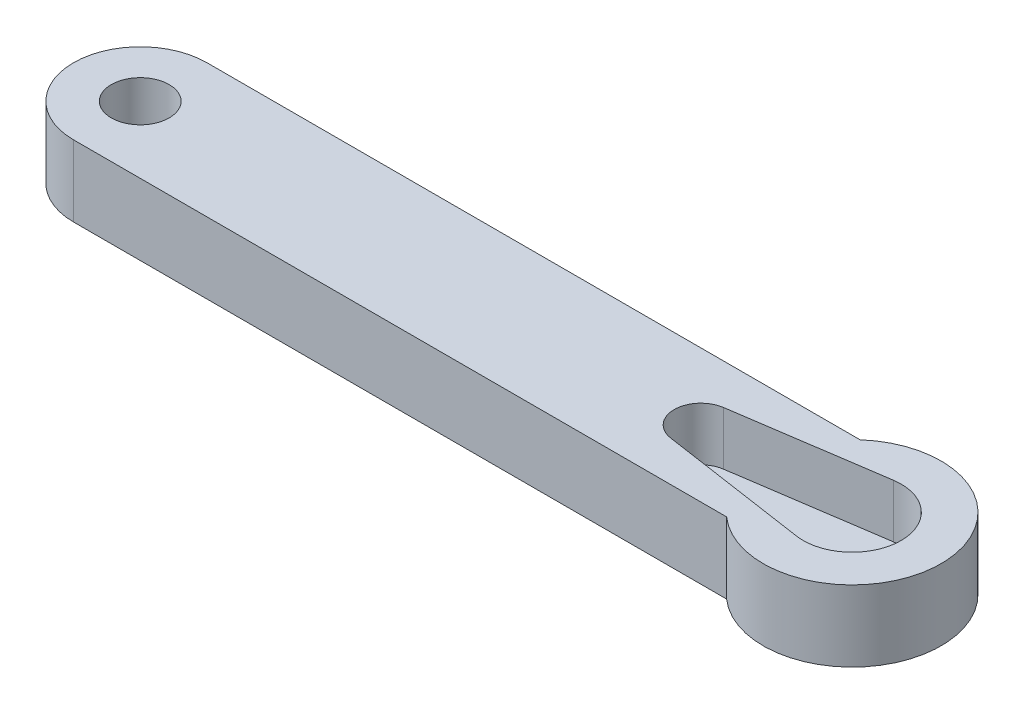
from build123d import *

# Parameters (mm, degrees)
SKETCH3_R           = 3.25
BOSS_EXTRUDE4_DEPTH = 8
SKETCH3_24_R        = 2.424842227
BOSS_EXTRUDE5_DEPTH = 2


with BuildPart() as part:
    # Sketch3 → Boss-Extrude4 (new body)
    with BuildSketch(Plane(origin=(0, 0, 0), x_dir=(1, 0, 0), z_dir=(0, 1, 0))):
        with BuildLine():
            Line((-87.854933508, -29.507885268), (-14.469311786, -29.507885268))
            ThreePointArc((-14.469311786, -29.507885268), (2.145066492, -22.007885268), (-14.469311786, -14.507885268))
            Line((-14.469311786, -14.507885268), (-87.854933508, -14.507885268))
            ThreePointArc((-87.854933508, -14.507885268), (-95.354933508, -22.007885268), (-87.854933508, -29.507885268))
        make_face()
        with BuildLine():
            ThreePointArc((-8.663757037, -16.567682652), (-2.354933508, -22.007885268), (-8.663757037, -27.448087883))
            Line((-8.663757037, -27.448087883), (-25.296109978, -24.975268512))
            ThreePointArc((-25.296109978, -24.975268512), (-27.854933508, -22.007885268), (-25.296109978, -19.040502023))
            Line((-25.296109978, -19.040502023), (-8.663757037, -16.567682652))
        make_face(mode=Mode.SUBTRACT)
        with Locations((-87.854933508, -22.007885268)):
            Circle(SKETCH3_R, mode=Mode.SUBTRACT)
    extrude(amount=BOSS_EXTRUDE4_DEPTH)


with BuildPart() as body_2:
    # Sketch3<24> → Boss-Extrude5 (new body)
    with BuildSketch(Plane(origin=(0, 0, 0), x_dir=(1, 0, 0), z_dir=(0, 1, 0))):
        with BuildLine():
            ThreePointArc((-8.663757037, -27.448087883), (-2.354933508, -22.007885268), (-8.663757037, -16.567682652))
            Line((-8.663757037, -16.567682652), (-25.296109978, -19.040502023))
            ThreePointArc((-25.296109978, -19.040502023), (-27.854933508, -22.007885268), (-25.296109978, -24.975268512))
            Line((-25.296109978, -24.975268512), (-8.663757037, -27.448087883))
        make_face()
        with Locations((-7.854933508, -22.007885268)):
            Circle(SKETCH3_24_R, mode=Mode.SUBTRACT)
    extrude(amount=BOSS_EXTRUDE5_DEPTH)


solid = Compound([part.part, body_2.part])
